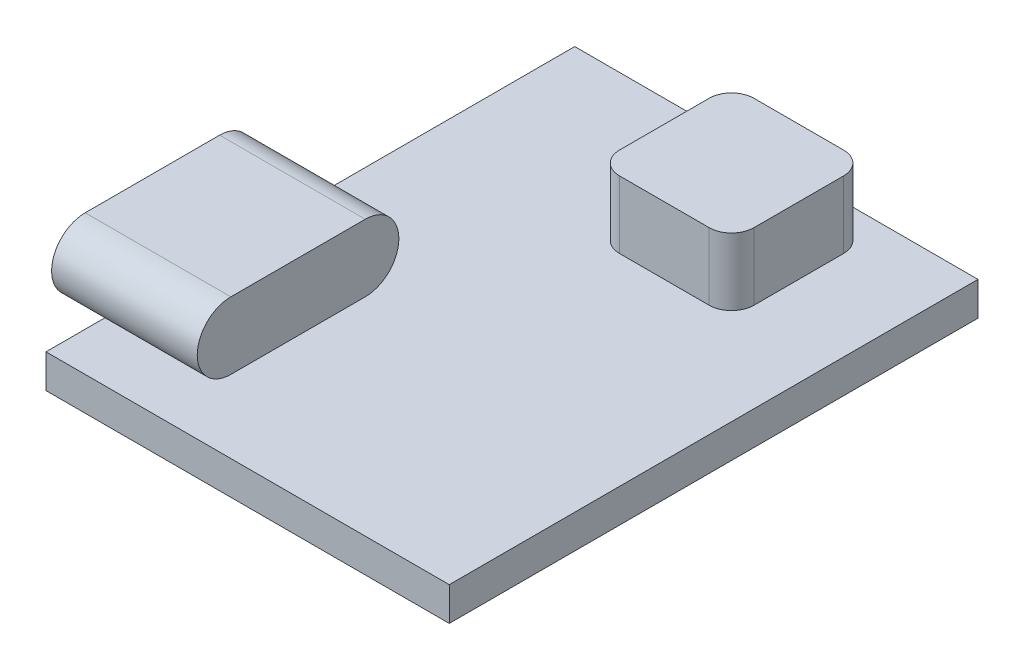
from build123d import *

# Parameters (mm, degrees)
SKETCH1_W                = 18
SKETCH1_H                = 23.6
BOSS_EXTRUDE1_DEPTH      = 1.5
BOSS_EXTRUDE2_DEPTH      = 1.5
BOSS_EXTRUDE2_DEPTH_BACK = 5
SHELL1_T                 = -0.3
SKETCH4_W                = 6
SKETCH4_H                = 6
BOSS_EXTRUDE3_DEPTH      = 3
FILLET1_R                = 1


with BuildPart() as part:
    # Sketch1 → Boss-Extrude1 (new body)
    with BuildSketch(Plane(origin=(0, 0, 0), x_dir=(1, 0, 0), z_dir=(0, 1, 0))):
        Rectangle(SKETCH1_W, SKETCH1_H)
    extrude(amount=BOSS_EXTRUDE1_DEPTH)


with BuildPart() as body_2:
    # Sketch3 → Boss-Extrude2 (new, two sides: drawn at the far end of the back side and taken through both)
    with BuildSketch(Plane.ZY.offset(9).offset(-BOSS_EXTRUDE2_DEPTH_BACK)):
        with BuildLine():
            Line((2.55, 4.5), (8.55, 4.5))
            ThreePointArc((8.55, 4.5), (10.05, 3), (8.55, 1.5))
            Line((8.55, 1.5), (2.55, 1.5))
            ThreePointArc((2.55, 1.5), (1.05, 3), (2.55, 4.5))
        make_face()
    extrude(amount=BOSS_EXTRUDE2_DEPTH + BOSS_EXTRUDE2_DEPTH_BACK)

    # Shell1
    shell1_openings = [body_2.faces().sort_by_distance(p)[0] for p in [
        (-10.5, 3, 5.55),
    ]]
    offset(amount=SHELL1_T, openings=shell1_openings, kind=Kind.INTERSECTION)


with BuildPart() as body_3:
    # Sketch4 → Boss-Extrude3 (new body)
    with BuildSketch(Plane(origin=(0, 1.5, 0), x_dir=(1, 0, 0), z_dir=(0, 1, 0))):
        with Locations((2, 7.8)):
            Rectangle(SKETCH4_W, SKETCH4_H)
    extrude(amount=BOSS_EXTRUDE3_DEPTH)

    # Fillet1
    fillet1_edges = [body_3.edges().sort_by_distance(p)[0] for p in [
        (-1, 3, -10.8),
        (5, 3, -10.8),
        (5, 3, -4.8),
        (-1, 3, -4.8),
    ]]
    fillet(fillet1_edges, radius=FILLET1_R)


solid = Compound([part.part, body_2.part, body_3.part])
